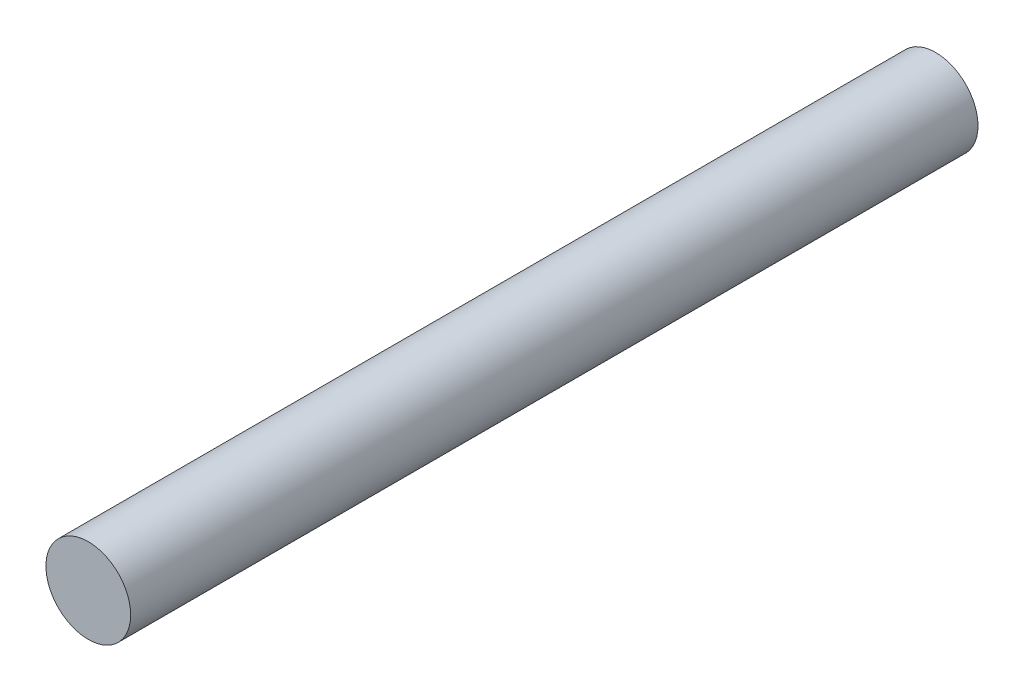
from build123d import *

# Parameters (mm, degrees)
CROQUIS1_R              = 1
SALIENTE_EXTRUIR1_DEPTH = 20


with BuildPart() as part:
    # Croquis1 → Saliente-Extruir1 (new body)
    with BuildSketch(Plane.XY):
        Circle(CROQUIS1_R)
    extrude(amount=SALIENTE_EXTRUIR1_DEPTH)


solid = part.part
